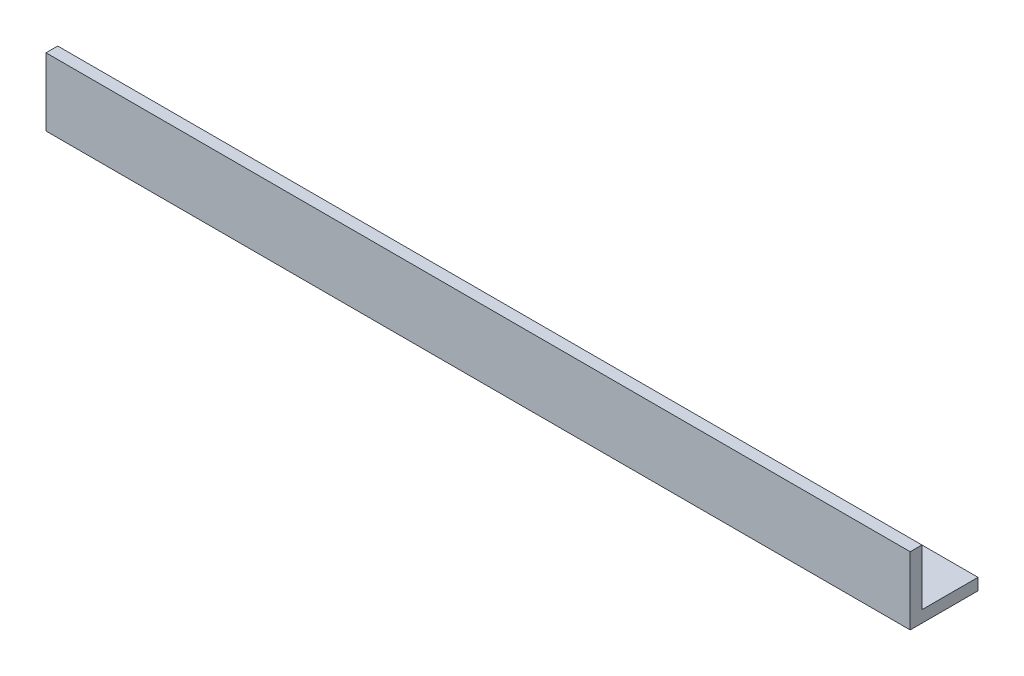
from build123d import *

# Parameters (mm, degrees)
BOSS_EXTRUDE1_DEPTH = 255


with BuildPart() as part:
    # Sketch1 → Boss-Extrude1 (new body)
    with BuildSketch(Plane(origin=(0, 0, 0), x_dir=(0, 0, -1), z_dir=(1, 0, 0))):
        Polygon((0, 0), (20, 0), (20, 3.461178467), (3.461178467, 3.461178467), (3.461178467, 20), (0, 20), align=None)
    extrude(amount=BOSS_EXTRUDE1_DEPTH)


solid = part.part
